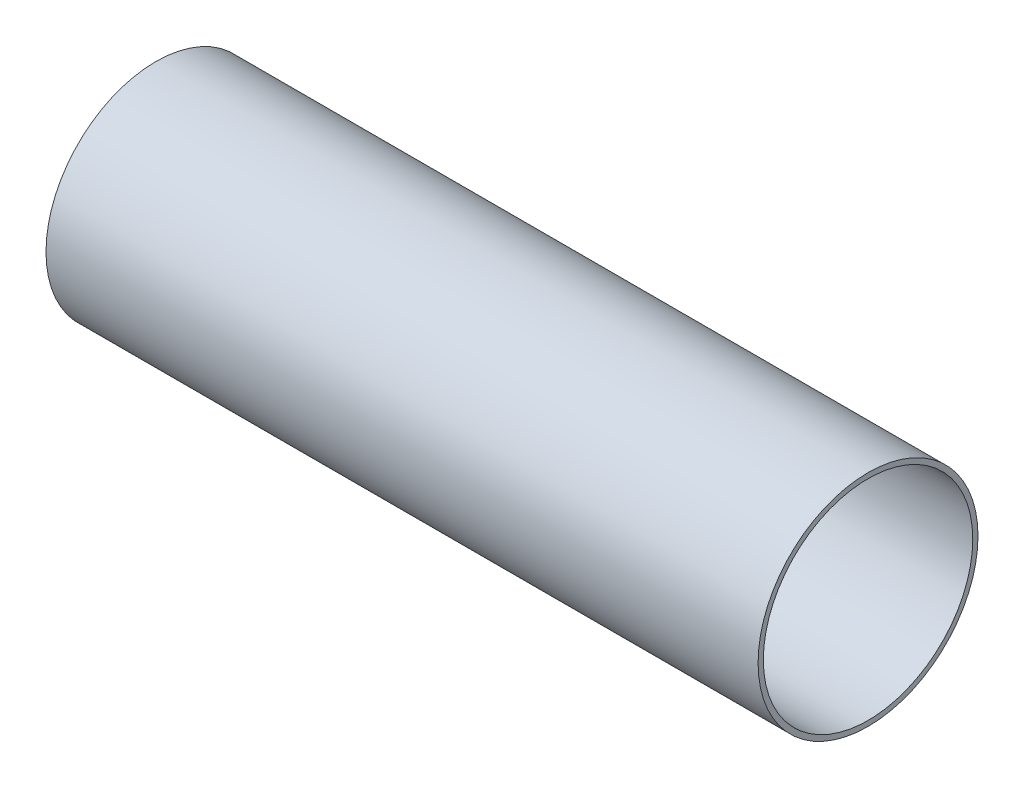
from build123d import *

# Parameters (mm, degrees)
SKETCH1_R           = 66.675
SKETCH1_R_2         = 63.5
BOSS_EXTRUDE1_DEPTH = 431.8


with BuildPart() as part:
    # Sketch1 → Boss-Extrude1 (new body)
    with BuildSketch(Plane(origin=(0, 0, 0), x_dir=(0, 0, -1), z_dir=(1, 0, 0))):
        Circle(SKETCH1_R)
        Circle(SKETCH1_R_2, mode=Mode.SUBTRACT)
    extrude(amount=BOSS_EXTRUDE1_DEPTH)


solid = part.part
